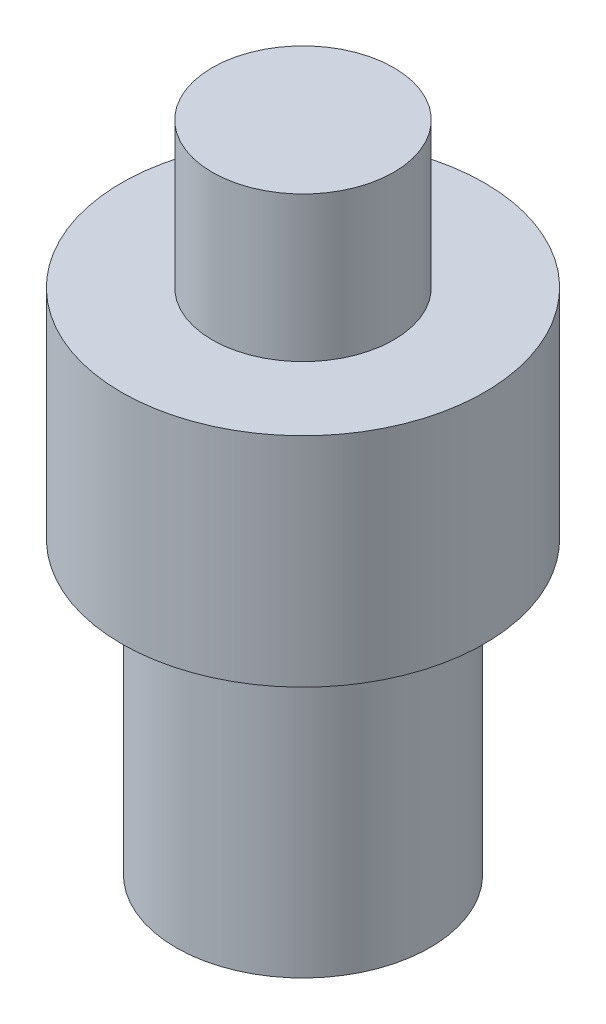
from build123d import *


with BuildPart() as part:
    # 草图1 → 旋转1 (revolve)
    with BuildSketch(Plane.XY, mode=Mode.PRIVATE) as revolve_1_sk:
        Polygon((0, -45), (17.5, -45), (17.5, -5), (25, -5), (25, 25), (12.5, 25), (12.5, 45), (0, 45), align=None)
    revolve(revolve_1_sk.sketch.rotate(Axis((0, -45, 0), (0, 1, 0)), 90), axis=Axis((0, -45, 0), (0, 1, 0)))


solid = part.part
